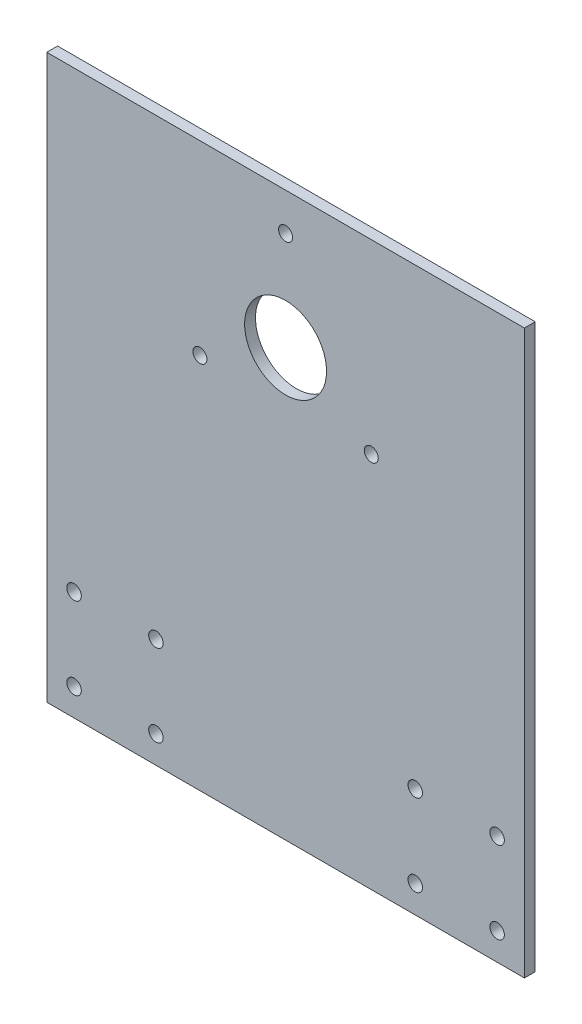
from build123d import *

# Parameters (mm, degrees)
SKETCH1_W           = 140
SKETCH1_H           = 165
SKETCH1_R           = 2.05
SKETCH1_R_2         = 12
SKETCH1_R_3         = 2.125
BOSS_EXTRUDE1_DEPTH = 3.175


with BuildPart() as part:
    # Sketch1 → Boss-Extrude1 (new body)
    with BuildSketch(Plane.XY):
        Rectangle(SKETCH1_W, SKETCH1_H)
        with Locations((0, 71.5)):
            Circle(SKETCH1_R, mode=Mode.SUBTRACT)
        with Locations((25.11473671, 28)):
            Circle(SKETCH1_R, mode=Mode.SUBTRACT)
        with Locations((-25.11473671, 28)):
            Circle(SKETCH1_R, mode=Mode.SUBTRACT)
        with Locations((0, 42.5)):
            Circle(SKETCH1_R_2, mode=Mode.SUBTRACT)
        with Locations((-62, -74.5)):
            Circle(SKETCH1_R_3, mode=Mode.SUBTRACT)
        with Locations(Location((-38, -74.5, 0), (0, 0, 180))):
            Circle(SKETCH1_R_3, mode=Mode.SUBTRACT)
        with Locations((-38, -50.5)):
            Circle(SKETCH1_R_3, mode=Mode.SUBTRACT)
        with Locations(Location((-62, -50.5, 0), (0, 0, 180))):
            Circle(SKETCH1_R_3, mode=Mode.SUBTRACT)
        with Locations((38, -74.5)):
            Circle(SKETCH1_R_3, mode=Mode.SUBTRACT)
        with Locations(Location((62, -74.5, 0), (0, 0, 180))):
            Circle(SKETCH1_R_3, mode=Mode.SUBTRACT)
        with Locations((62, -50.5)):
            Circle(SKETCH1_R_3, mode=Mode.SUBTRACT)
        with Locations(Location((38, -50.5, 0), (0, 0, 180))):
            Circle(SKETCH1_R_3, mode=Mode.SUBTRACT)
    extrude(amount=BOSS_EXTRUDE1_DEPTH)


solid = part.part
